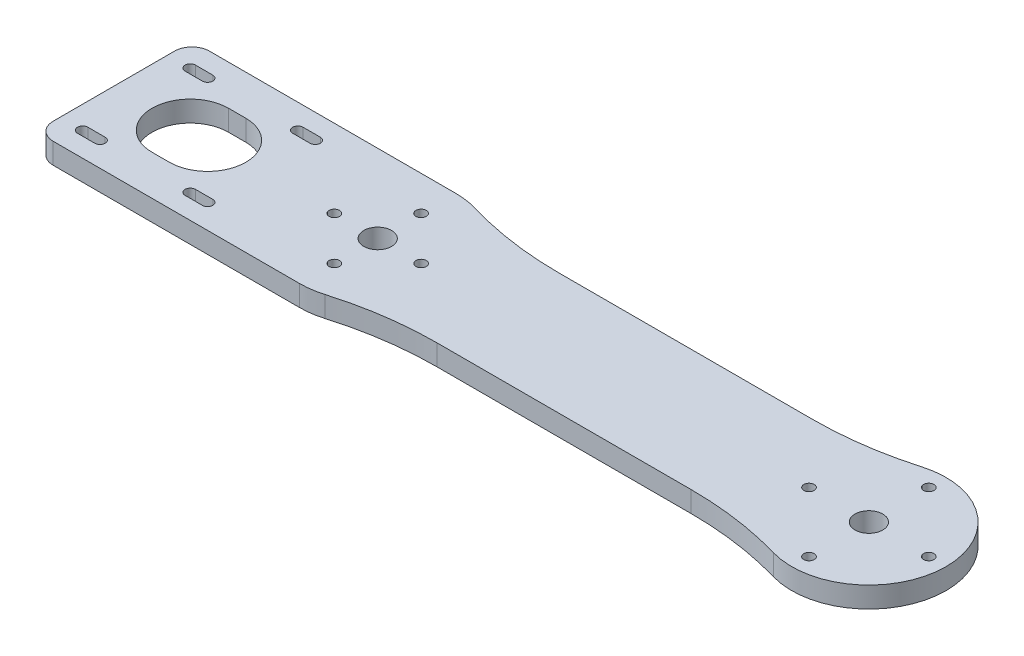
from build123d import *

# Parameters (mm, degrees)
SKETCH1_R           = 4
BOSS_EXTRUDE1_DEPTH = 6
BOSS_EXTRUDE2_START = -6
SKETCH2_R           = 4
BOSS_EXTRUDE2_DEPTH = 6
FILLET1_R           = 5
SKETCH3_R           = 1.5
CUT_EXTRUDE1_DEPTH  = 19
SKETCH4_R           = 1.5
CUT_EXTRUDE2_DEPTH  = 19
FILLET2_R           = 100


with BuildPart() as part:
    # Sketch1 → Boss-Extrude1 (new body)
    with BuildSketch(Plane(origin=(0, 0, 0), x_dir=(1, 0, 0), z_dir=(0, 1, 0))):
        with BuildLine():
            Line((0, -17.5), (127.759093916, -17.5))
            ThreePointArc((127.759093916, -17.5), (163.75, 0), (127.759093916, 17.5))
            Line((127.759093916, 17.5), (0, 17.5))
            ThreePointArc((0, 17.5), (-17.5, 0), (0, -17.5))
        make_face()
        with Locations(Location((141.5, 0, 0), (0, 0, 270))):
            Circle(SKETCH1_R, mode=Mode.SUBTRACT)
        with Locations(Location((0, 0, 0), (0, 0, 270))):
            Circle(SKETCH1_R, mode=Mode.SUBTRACT)
    extrude(amount=BOSS_EXTRUDE1_DEPTH)

    # Sketch2 → Boss-Extrude2 (add)
    with BuildSketch(Plane(origin=(0, 6, 0), x_dir=(1, 0, 0), z_dir=(0, 1, 0)).offset(BOSS_EXTRUDE2_START)):
        with BuildLine():
            ThreePointArc((0, -22.5), (22.5, 0), (0, 22.5))
            Line((0, 22.5), (-76, 22.5))
            Line((-76, 22.5), (-76, -22.5))
            Line((-76, -22.5), (0, -22.5))
        make_face()
        with BuildLine():
            Line((-64.5, -17), (-69.5, -17))
            ThreePointArc((-69.5, -17), (-71, -15.5), (-69.5, -14))
            Line((-69.5, -14), (-64.5, -14))
            ThreePointArc((-64.5, -14), (-63, -15.5), (-64.5, -17))
        make_face(mode=Mode.SUBTRACT)
        with BuildLine():
            Line((-38.5, -14), (-37.5, -14))
            Line((-37.5, -14), (-33.5, -14))
            ThreePointArc((-33.5, -14), (-32, -15.5), (-33.5, -17))
            Line((-33.5, -17), (-38.5, -17))
            ThreePointArc((-38.5, -17), (-40, -15.5), (-38.5, -14))
        make_face(mode=Mode.SUBTRACT)
        with BuildLine():
            ThreePointArc((-49, 11), (-38.531049744, 3.376548613), (-42.572923734, -8.927076266))
            ThreePointArc((-42.572923734, -8.927076266), (-45.623451387, -10.468950256), (-49, -11))
            Line((-49, -11), (-54, -11))
            ThreePointArc((-54, -11), (-61.778174593, -7.778174593), (-65, 0))
            ThreePointArc((-65, 0), (-61.778174593, 7.778174593), (-54, 11))
            Line((-54, 11), (-49, 11))
        make_face(mode=Mode.SUBTRACT)
        with BuildLine():
            ThreePointArc((-64.5, 17), (-63, 15.5), (-64.5, 14))
            Line((-64.5, 14), (-69.5, 14))
            ThreePointArc((-69.5, 14), (-71, 15.5), (-69.5, 17))
            Line((-69.5, 17), (-64.5, 17))
        make_face(mode=Mode.SUBTRACT)
        with BuildLine():
            ThreePointArc((-33.5, 17), (-32, 15.5), (-33.5, 14))
            Line((-33.5, 14), (-38.5, 14))
            ThreePointArc((-38.5, 14), (-40, 15.5), (-38.5, 17))
            Line((-38.5, 17), (-33.5, 17))
        make_face(mode=Mode.SUBTRACT)
        with Locations(Location((0, 0, 0), (0, 0, 270))):
            Circle(SKETCH2_R, mode=Mode.SUBTRACT)
    extrude(amount=BOSS_EXTRUDE2_DEPTH)

    # Fillet1
    fillet1_edges = [part.edges().sort_by_distance(p)[0] for p in [
        (-76, 3, 22.5),
        (-76, 3, -22.5),
    ]]
    fillet(fillet1_edges, radius=FILLET1_R)

    # Sketch3 → Cut-Extrude1 (cut)
    with BuildSketch(Plane(origin=(0, 6, 0), x_dir=(1, 0, 0), z_dir=(0, 1, 0))):
        with Locations(Location((0, 12.5, 0), (0, 0, 270))):
            Circle(SKETCH3_R)
        with Locations(Location((12.5, 0, 0), (0, 0, 270))):
            Circle(SKETCH3_R)
        with Locations(Location((0, -12.5, 0), (0, 0, 270))):
            Circle(SKETCH3_R)
        with Locations(Location((-12.5, 0, 0), (0, 0, 270))):
            Circle(SKETCH3_R)
    extrude(amount=-CUT_EXTRUDE1_DEPTH, mode=Mode.SUBTRACT)

    # Sketch4 → Cut-Extrude2 (cut)
    with BuildSketch(Plane(origin=(0, 6, 0), x_dir=(1, 0, 0), z_dir=(0, 1, 0))):
        with Locations(Location((158.75, 0, 0), (0, 0, 270))):
            Circle(SKETCH4_R)
        with Locations(Location((141.5, -17.25, 0), (0, 0, 270))):
            Circle(SKETCH4_R)
        with Locations(Location((124.25, 0, 0), (0, 0, 270))):
            Circle(SKETCH4_R)
        with Locations(Location((141.5, 17.25, 0), (0, 0, 270))):
            Circle(SKETCH4_R)
    extrude(amount=-CUT_EXTRUDE2_DEPTH, mode=Mode.SUBTRACT)

    # Fillet2
    fillet2_edges = [part.edges().sort_by_distance(p)[0] for p in [
        (127.759093916, 3, -17.5),
        (127.759093916, 3, 17.5),
        (14.142135624, 3, -17.5),
        (14.142135624, 3, 17.5),
    ]]
    fillet(fillet2_edges, radius=FILLET2_R)


solid = part.part
